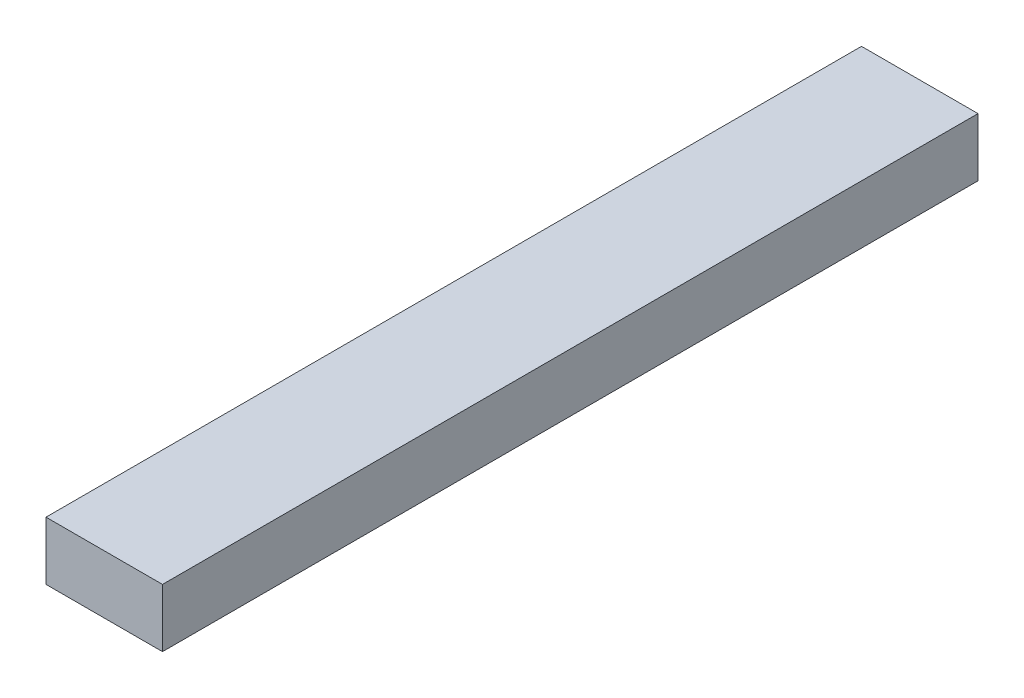
from build123d import *

# Parameters (mm, degrees)
SKETCH_1_W      = 50.8
SKETCH_1_H      = 25.4
EXTRUDE_1_DEPTH = 355.6


with BuildPart() as part:
    # 草图1 → 凸台-拉伸1 (new body)
    with BuildSketch(Plane.XY):
        with Locations((-4.80306644, -1.709199319)):
            Rectangle(SKETCH_1_W, SKETCH_1_H)
    extrude(amount=EXTRUDE_1_DEPTH)


solid = part.part
